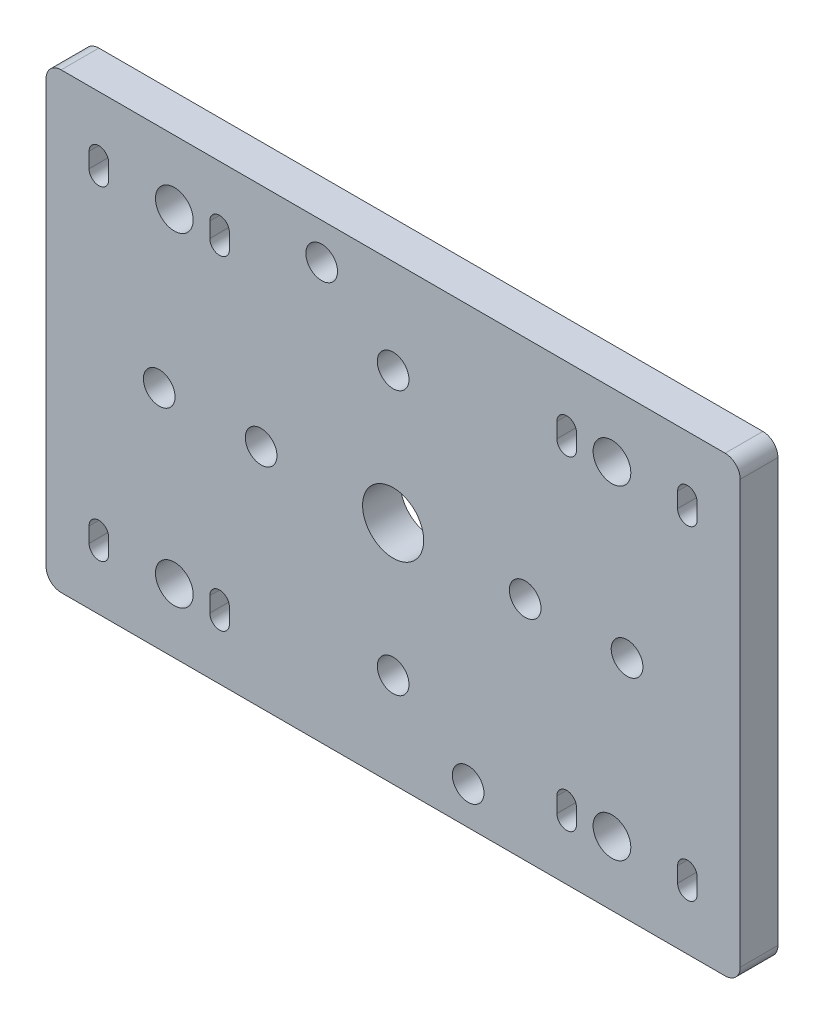
from build123d import *

# Parameters (mm, degrees)
SKETCH1_W           = 92
SKETCH1_H           = 60
SKETCH1_R           = 4.05
SKETCH1_R_2         = 2.1
SKETCH1_R_3         = 2.5
BOSS_EXTRUDE1_DEPTH = 2.5
FILLET1_R           = 2


with BuildPart() as part:
    # Sketch1 → Boss-Extrude1 (new, symmetric)
    with BuildSketch(Plane.XY):
        Rectangle(SKETCH1_W, SKETCH1_H)
        Circle(SKETCH1_R, mode=Mode.SUBTRACT)
        with Locations((0, 17.5)):
            Circle(SKETCH1_R_2, mode=Mode.SUBTRACT)
        with Locations((0, -17.5)):
            Circle(SKETCH1_R_2, mode=Mode.SUBTRACT)
        with Locations((-17.5, 0)):
            Circle(SKETCH1_R_2, mode=Mode.SUBTRACT)
        with Locations((17.5, 0)):
            Circle(SKETCH1_R_2, mode=Mode.SUBTRACT)
        with Locations((29, 21.5)):
            Circle(SKETCH1_R_3, mode=Mode.SUBTRACT)
        with Locations((29, -21.5)):
            Circle(SKETCH1_R_3, mode=Mode.SUBTRACT)
        with Locations((-29, -21.5)):
            Circle(SKETCH1_R_3, mode=Mode.SUBTRACT)
        with Locations((-29, 21.5)):
            Circle(SKETCH1_R_3, mode=Mode.SUBTRACT)
        with Locations((-31, 0)):
            Circle(SKETCH1_R_2, mode=Mode.SUBTRACT)
        with Locations((31, 0)):
            Circle(SKETCH1_R_2, mode=Mode.SUBTRACT)
        with Locations((9.941037343, -25)):
            Circle(SKETCH1_R_2, mode=Mode.SUBTRACT)
        with Locations((-9.466357856, 25.166900153)):
            Circle(SKETCH1_R_2, mode=Mode.SUBTRACT)
        with BuildLine():
            Line((37.7, 20.5), (37.7, 22.5))
            ThreePointArc((37.7, 22.5), (39, 23.8), (40.3, 22.5))
            Line((40.3, 22.5), (40.3, 20.5))
            ThreePointArc((40.3, 20.5), (39, 19.2), (37.7, 20.5))
        make_face(mode=Mode.SUBTRACT)
        with BuildLine():
            Line((21.7, 20.5), (21.7, 22.5))
            ThreePointArc((21.7, 22.5), (23, 23.8), (24.3, 22.5))
            Line((24.3, 22.5), (24.3, 20.5))
            ThreePointArc((24.3, 20.5), (23, 19.2), (21.7, 20.5))
        make_face(mode=Mode.SUBTRACT)
        with BuildLine():
            Line((37.7, -20.5), (37.7, -22.5))
            ThreePointArc((37.7, -22.5), (39, -23.8), (40.3, -22.5))
            Line((40.3, -22.5), (40.3, -20.5))
            ThreePointArc((40.3, -20.5), (39, -19.2), (37.7, -20.5))
        make_face(mode=Mode.SUBTRACT)
        with BuildLine():
            Line((21.7, -20.5), (21.7, -22.5))
            ThreePointArc((21.7, -22.5), (23, -23.8), (24.3, -22.5))
            Line((24.3, -22.5), (24.3, -20.5))
            ThreePointArc((24.3, -20.5), (23, -19.2), (21.7, -20.5))
        make_face(mode=Mode.SUBTRACT)
        with BuildLine():
            Line((-21.7, -20.5), (-21.7, -22.5))
            ThreePointArc((-21.7, -22.5), (-23, -23.8), (-24.3, -22.5))
            Line((-24.3, -22.5), (-24.3, -20.5))
            ThreePointArc((-24.3, -20.5), (-23, -19.2), (-21.7, -20.5))
        make_face(mode=Mode.SUBTRACT)
        with BuildLine():
            Line((-37.7, -20.5), (-37.7, -22.5))
            ThreePointArc((-37.7, -22.5), (-39, -23.8), (-40.3, -22.5))
            Line((-40.3, -22.5), (-40.3, -20.5))
            ThreePointArc((-40.3, -20.5), (-39, -19.2), (-37.7, -20.5))
        make_face(mode=Mode.SUBTRACT)
        with BuildLine():
            Line((-21.7, 20.5), (-21.7, 22.5))
            ThreePointArc((-21.7, 22.5), (-23, 23.8), (-24.3, 22.5))
            Line((-24.3, 22.5), (-24.3, 20.5))
            ThreePointArc((-24.3, 20.5), (-23, 19.2), (-21.7, 20.5))
        make_face(mode=Mode.SUBTRACT)
        with BuildLine():
            Line((-37.7, 20.5), (-37.7, 22.5))
            ThreePointArc((-37.7, 22.5), (-39, 23.8), (-40.3, 22.5))
            Line((-40.3, 22.5), (-40.3, 20.5))
            ThreePointArc((-40.3, 20.5), (-39, 19.2), (-37.7, 20.5))
        make_face(mode=Mode.SUBTRACT)
    extrude(amount=BOSS_EXTRUDE1_DEPTH, both=True)

    # Fillet1
    fillet1_edges = [part.edges().sort_by_distance(p)[0] for p in [
        (-46, -30, 0),
        (-46, 30, 0),
        (46, 30, 0),
        (46, -30, 0),
    ]]
    fillet(fillet1_edges, radius=FILLET1_R)


solid = part.part
